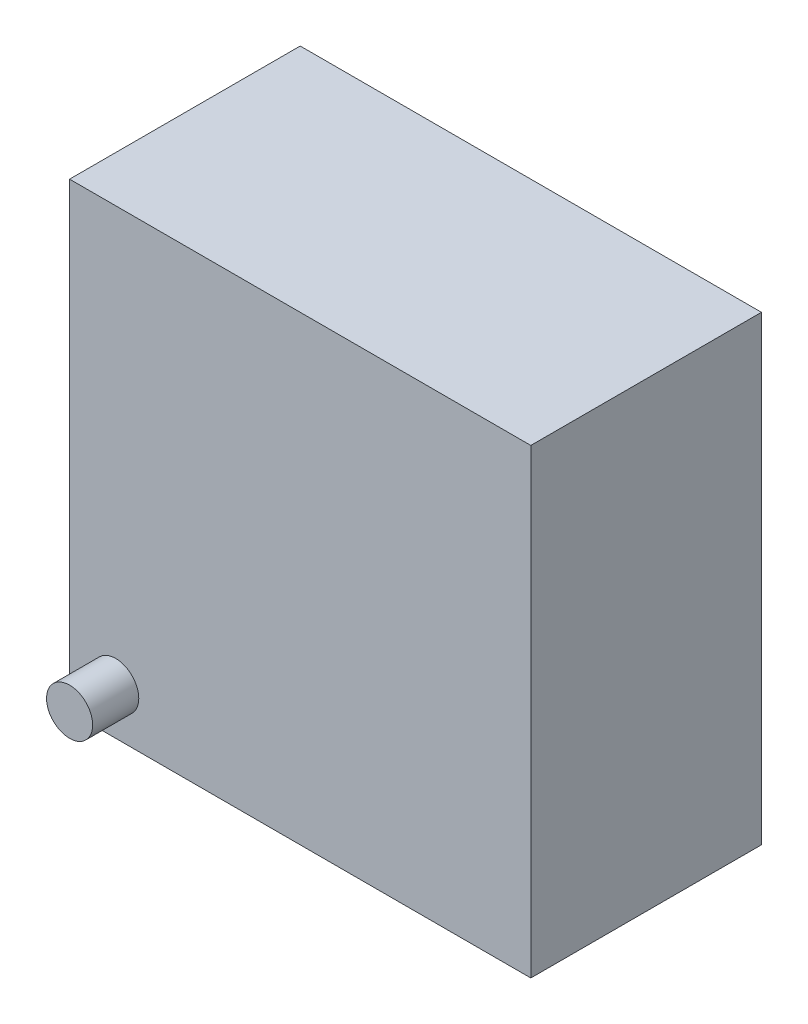
from build123d import *

# Parameters (mm, degrees)
SKETCH_1_W     = 20
SKETCH_1_H     = 20
BASEBOX_DEPTH  = 10
SKETCH_2_R     = 1
BOSSSEED_DEPTH = 2


with BuildPart() as part:
    # 草图1 → BaseBox (new body)
    with BuildSketch(Plane.XY):
        with Locations((10, 10)):
            Rectangle(SKETCH_1_W, SKETCH_1_H)
    extrude(amount=BASEBOX_DEPTH)

    # 草图2 → BossSeed (add)
    with BuildSketch(Plane.XY.offset(10)):
        with Locations((2, 2)):
            Circle(SKETCH_2_R)
    extrude(amount=BOSSSEED_DEPTH)


solid = part.part
